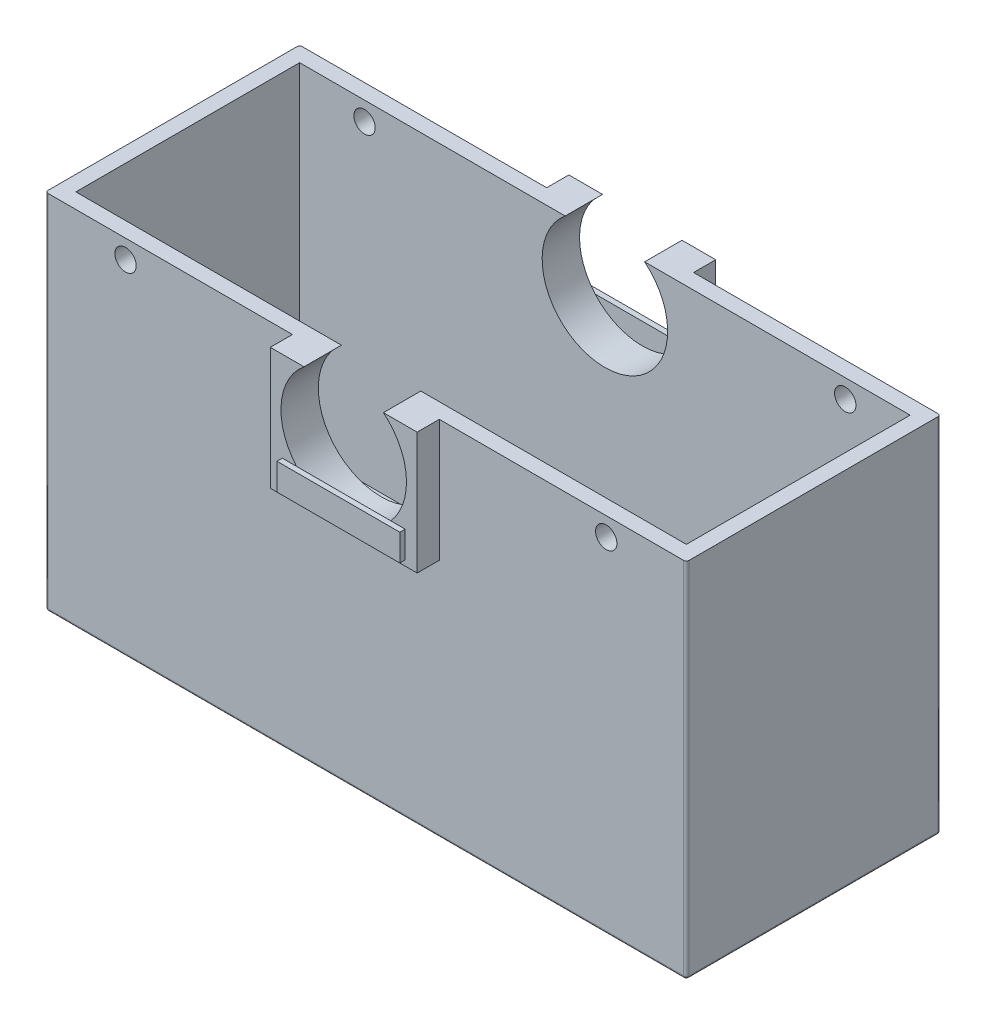
from build123d import *

# Parameters (mm, degrees)
SKETCH1_W               = 95.2
SKETCH1_H               = 135.7
BOSS_EXTRUDE1_DEPTH     = 240
SKETCH3_W               = 228.6
SKETCH3_H               = 83.8
CUT_EXTRUDE1_DEPTH      = 124.3
FILLET1_R               = 1
SKETCH6_R               = 23.5
CUT_EXTRUDE2_DEPTH      = 140
SKETCH7_W               = 55
SKETCH7_H               = 45.7
BOSS_EXTRUDE2_DEPTH     = 8.3
SKETCH8_R               = 23.5
CUT_EXTRUDE3_DEPTH      = 295.494040687
SKETCH9_W               = 55
SKETCH9_H               = 45.7
BOSS_EXTRUDE3_DEPTH     = 8.3
SKETCH10_R              = 23.5
CUT_EXTRUDE4_DEPTH      = 298.512571163
CUT_EXTRUDE5_DEPTH      = 295.494040687
CUT_EXTRUDE5_DEPTH_BACK = 295.494040687
SKETCH11_R              = 4
SKETCH12_W              = 46
SKETCH12_H              = 10
BOSS_EXTRUDE4_DEPTH     = 2
SKETCH13_W              = 46
SKETCH13_H              = 10
BOSS_EXTRUDE5_DEPTH     = 2


with BuildPart() as part:
    # Sketch1 → Boss-Extrude1 (new body)
    with BuildSketch(Plane(origin=(0, 0, 0), x_dir=(0, 0, -1), z_dir=(1, 0, 0))):
        with Locations((47.6, 67.85)):
            Rectangle(SKETCH1_W, SKETCH1_H)
    extrude(amount=-BOSS_EXTRUDE1_DEPTH)

    # Sketch3 → Cut-Extrude1 (cut)
    with BuildSketch(Plane(origin=(0, 135.7, 0), x_dir=(1, 0, 0), z_dir=(0, 1, 0))):
        with Locations((-120, 47.6)):
            Rectangle(SKETCH3_W, SKETCH3_H)
    extrude(amount=-CUT_EXTRUDE1_DEPTH, mode=Mode.SUBTRACT)

    # Fillet1
    fillet1_edges = [part.edges().sort_by_distance(p)[0] for p in [
        (-240, 67.85, -95.2),
        (-240, 67.85, 0),
        (0, 67.85, -95.2),
        (0, 0, -47.6),
        (0, 67.85, 0),
        (-120, 0, -95.2),
        (-120, 0, 0),
        (-240, 0, -47.6),
    ]]
    fillet(fillet1_edges, radius=FILLET1_R)

    # Sketch6 → Cut-Extrude2 (cut)
    with BuildSketch(Plane.XY):
        with Locations((-120, 117.5)):
            Circle(SKETCH6_R)
    extrude(amount=-CUT_EXTRUDE2_DEPTH, mode=Mode.SUBTRACT)

    # Sketch7 → Boss-Extrude2 (add)
    with BuildSketch(Plane.XY):
        with Locations((-120, 112.85)):
            Rectangle(SKETCH7_W, SKETCH7_H)
    extrude(amount=BOSS_EXTRUDE2_DEPTH)

    # Sketch8 → Cut-Extrude3 (cut, through all)
    with BuildSketch(Plane(origin=(0, 0, -95.2), x_dir=(-1, 0, 0), z_dir=(0, 0, -1))):
        with Locations((120, 117.5)):
            Circle(SKETCH8_R)
    extrude(amount=-CUT_EXTRUDE3_DEPTH, mode=Mode.SUBTRACT)

    # Sketch9 → Boss-Extrude3 (add)
    with BuildSketch(Plane(origin=(0, 0, -95.2), x_dir=(-1, 0, 0), z_dir=(0, 0, -1))):
        with Locations((120, 112.85)):
            Rectangle(SKETCH9_W, SKETCH9_H)
    extrude(amount=BOSS_EXTRUDE3_DEPTH)

    # Sketch10 → Cut-Extrude4 (cut, through all)
    with BuildSketch(Plane.XY.offset(8.3)):
        with Locations((-120, 117.5)):
            Circle(SKETCH10_R)
    extrude(amount=-CUT_EXTRUDE4_DEPTH, mode=Mode.SUBTRACT)

    # Sketch11 → Cut-Extrude5 (cut, two sides: drawn at the far end of the back side and taken through both)
    with BuildSketch(Plane.XY.offset(-CUT_EXTRUDE5_DEPTH_BACK)):
        with Locations((-30, 128.7)):
            Circle(SKETCH11_R)
        with Locations((-210, 128.7)):
            Circle(SKETCH11_R)
    extrude(amount=CUT_EXTRUDE5_DEPTH + CUT_EXTRUDE5_DEPTH_BACK, mode=Mode.SUBTRACT)

    # Sketch12 → Boss-Extrude4 (add)
    with BuildSketch(Plane.XY.offset(8.3)):
        with Locations((-120, 97)):
            Rectangle(SKETCH12_W, SKETCH12_H)
    extrude(amount=BOSS_EXTRUDE4_DEPTH)

    # Sketch13 → Boss-Extrude5 (add)
    with BuildSketch(Plane(origin=(0, 0, -103.5), x_dir=(-1, 0, 0), z_dir=(0, 0, -1))):
        with Locations((120, 97)):
            Rectangle(SKETCH13_W, SKETCH13_H)
    extrude(amount=BOSS_EXTRUDE5_DEPTH)


solid = part.part
